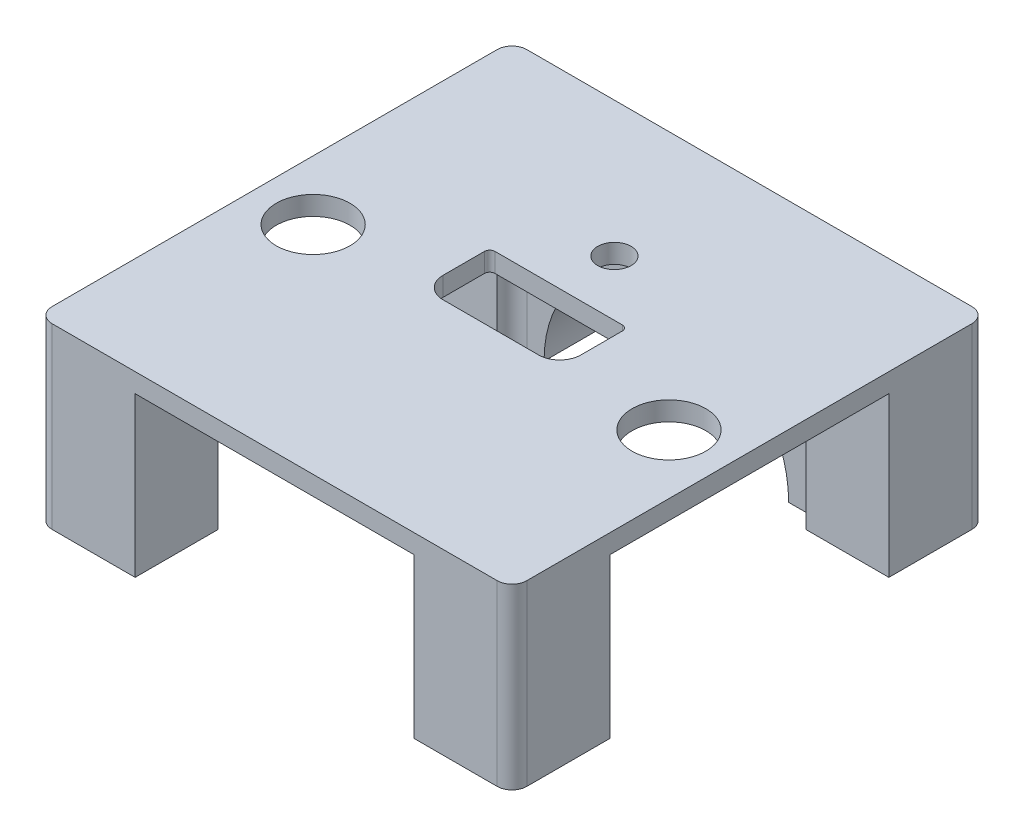
from build123d import *

# Parameters (mm, degrees)
SKETCH2_R           = 1.575
BOSS_EXTRUDE3_DEPTH = 1.8
BOSS_EXTRUDE4_START = 15
BOSS_EXTRUDE4_DEPTH = 15
CUT_EXTRUDE1_REACH  = 54.232
SKETCH4_R           = 11.530245675
SKETCH5_R           = 3.475
CUT_EXTRUDE2_DEPTH  = 36.826264807


with BuildPart() as part:
    # Sketch2 → Boss-Extrude3 (new body)
    with BuildSketch(Plane(origin=(0, 0, 0), x_dir=(1, 0, 0), z_dir=(0, 1, 0))):
        with BuildLine():
            Line((-20.975, -22.375), (20.975, -22.375))
            ThreePointArc((20.975, -22.375), (21.964949494, -21.964949494), (22.375, -20.975))
            Line((22.375, -20.975), (22.375, 20.975))
            ThreePointArc((22.375, 20.975), (21.964949494, 21.964949494), (20.975, 22.375))
            Line((20.975, 22.375), (-20.975, 22.375))
            ThreePointArc((-20.975, 22.375), (-21.964949494, 21.964949494), (-22.375, 20.975))
            Line((-22.375, 20.975), (-22.375, -20.975))
            ThreePointArc((-22.375, -20.975), (-21.964949494, -21.964949494), (-20.975, -22.375))
        make_face()
        with Locations(Location((0, 9.655, 0), (0, 0, 270))):
            Circle(SKETCH2_R, mode=Mode.SUBTRACT)
        with BuildLine():
            Line((-4.5, -2), (4.5, -2))
            ThreePointArc((4.5, -2), (5.914213562, -1.414213562), (6.5, 0))
            Line((6.5, 0), (6.5, 3.9))
            ThreePointArc((6.5, 3.9), (6.353553391, 4.253553391), (6, 4.4))
            Line((6, 4.4), (-6, 4.4))
            ThreePointArc((-6, 4.4), (-6.353553391, 4.253553391), (-6.5, 3.9))
            Line((-6.5, 3.9), (-6.5, 0))
            ThreePointArc((-6.5, 0), (-5.914213562, -1.414213562), (-4.5, -2))
        make_face(mode=Mode.SUBTRACT)
    extrude(amount=BOSS_EXTRUDE3_DEPTH)

    # Sketch3 → Boss-Extrude4 (add)
    with BuildSketch(Plane.XZ.offset(BOSS_EXTRUDE4_START)):
        with BuildLine():
            Line((-20.975, -22.375), (20.975, -22.375))
            ThreePointArc((20.975, -22.375), (21.964949494, -21.964949494), (22.375, -20.975))
            Line((22.375, -20.975), (22.375, -13.15))
            Line((22.375, -13.15), (14.55, -13.15))
            ThreePointArc((14.55, -13.15), (14.139949494, -14.139949494), (13.15, -14.55))
            Line((13.15, -14.55), (-13.15, -14.55))
            ThreePointArc((-13.15, -14.55), (-14.139949494, -14.139949494), (-14.55, -13.15))
            Line((-14.55, -13.15), (-22.375, -13.15))
            Line((-22.375, -13.15), (-22.375, -20.975))
            ThreePointArc((-22.375, -20.975), (-21.964949494, -21.964949494), (-20.975, -22.375))
        make_face()
        with BuildLine():
            Line((-20.975, 22.375), (-13.15, 22.375))
            Line((-13.15, 22.375), (-13.15, 14.55))
            ThreePointArc((-13.15, 14.55), (-14.139949494, 14.139949494), (-14.55, 13.15))
            Line((-14.55, 13.15), (-22.375, 13.15))
            Line((-22.375, 13.15), (-22.375, 20.975))
            ThreePointArc((-22.375, 20.975), (-21.964949494, 21.964949494), (-20.975, 22.375))
        make_face()
        with BuildLine():
            Line((14.55, 13.15), (22.375, 13.15))
            Line((22.375, 13.15), (22.375, 20.975))
            ThreePointArc((22.375, 20.975), (21.964949494, 21.964949494), (20.975, 22.375))
            Line((20.975, 22.375), (13.15, 22.375))
            Line((13.15, 22.375), (13.15, 14.55))
            ThreePointArc((13.15, 14.55), (14.139949494, 14.139949494), (14.55, 13.15))
        make_face()
    extrude(amount=-BOSS_EXTRUDE4_DEPTH)

    # Sketch4 → Cut-Extrude1 (cut, up to next)
    with BuildSketch(Plane(origin=(0, 0, -22.375), x_dir=(-1, 0, 0), z_dir=(0, 0, -1)), mode=Mode.PRIVATE) as cut_extrude1_sk1:
        with Locations((0, -15)):
            Circle(SKETCH4_R)
    cut_extrude1_tool1 = extrude(cut_extrude1_sk1.sketch, amount=-CUT_EXTRUDE1_REACH, mode=Mode.PRIVATE) & part.part
    add(cut_extrude1_tool1.solids().sort_by_distance((0, -15, -22.375))[0], mode=Mode.SUBTRACT)

    # Sketch5 → Cut-Extrude2 (cut, through all)
    with BuildSketch(Plane(origin=(0, 1.8, 0), x_dir=(1, 0, 0), z_dir=(0, 1, 0))):
        with Locations(Location((-16.77, -1.975, 0), (0, 0, 270))):
            Circle(SKETCH5_R)
        with Locations(Location((16.77, -1.975, 0), (0, 0, 270))):
            Circle(SKETCH5_R)
    extrude(amount=-CUT_EXTRUDE2_DEPTH, mode=Mode.SUBTRACT)


solid = part.part
